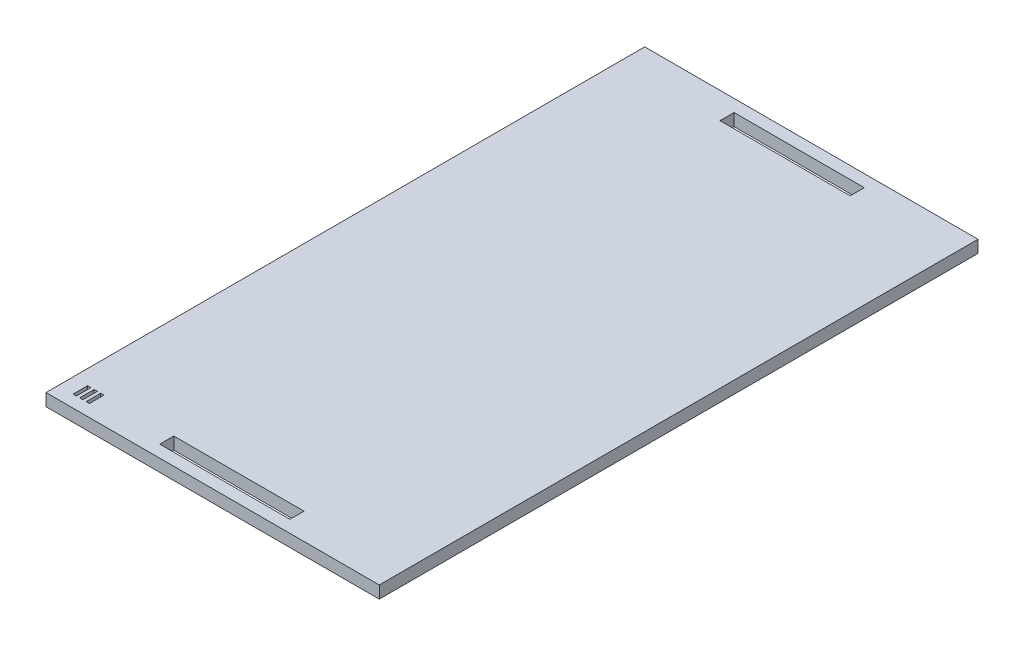
from build123d import *

# Parameters (mm, degrees)
SKETCH1_W           = 81.2942748
SKETCH1_H           = 146.05
SKETCH1_W_2         = 31.75
SKETCH1_H_2         = 3.429
SKETCH1_W_3         = 0.79375
SKETCH1_H_3         = 3.556
BOSS_EXTRUDE1_DEPTH = 2.9972


with BuildPart() as part:
    # Sketch1 → Boss-Extrude1 (new body)
    with BuildSketch(Plane(origin=(0, 0, 0), x_dir=(1, 0, 0), z_dir=(0, 1, 0))):
        Rectangle(SKETCH1_W, SKETCH1_H)
        with Locations((0, 68.3387)):
            Rectangle(SKETCH1_W_2, SKETCH1_H_2, mode=Mode.SUBTRACT)
        with Locations((0, -68.3387)):
            Rectangle(SKETCH1_W_2, SKETCH1_H_2, mode=Mode.SUBTRACT)
        with Locations((-36.61676177, -68.2752)):
            Rectangle(SKETCH1_W_3, SKETCH1_H_3, mode=Mode.SUBTRACT)
        with Locations((-35.02926177, -68.2752)):
            Rectangle(SKETCH1_W_3, SKETCH1_H_3, mode=Mode.SUBTRACT)
        with Locations((-33.44176177, -68.2752)):
            Rectangle(SKETCH1_W_3, SKETCH1_H_3, mode=Mode.SUBTRACT)
    extrude(amount=BOSS_EXTRUDE1_DEPTH)


solid = part.part
